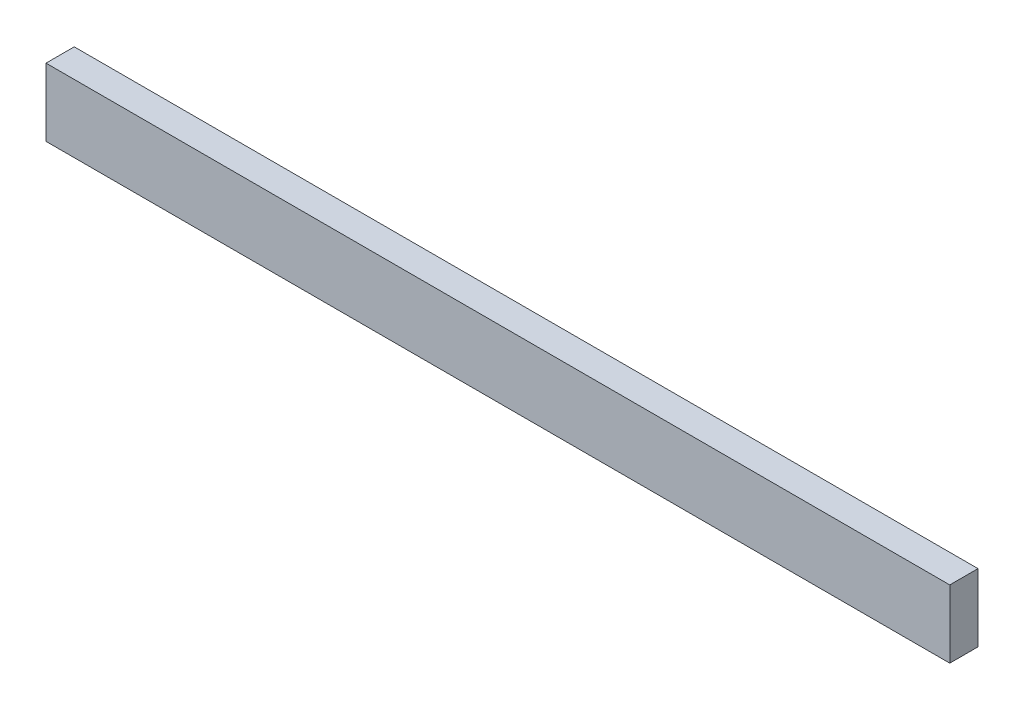
from build123d import *

# Parameters (mm, degrees)
ESQUISSE1_W        = 800
ESQUISSE1_H        = 60
BOSS_EXTRU_1_DEPTH = 25


with BuildPart() as part:
    # Esquisse1 → Boss.-Extru.1 (new body)
    with BuildSketch(Plane.XY):
        with Locations((400, 30)):
            Rectangle(ESQUISSE1_W, ESQUISSE1_H)
    extrude(amount=BOSS_EXTRU_1_DEPTH)


solid = part.part
